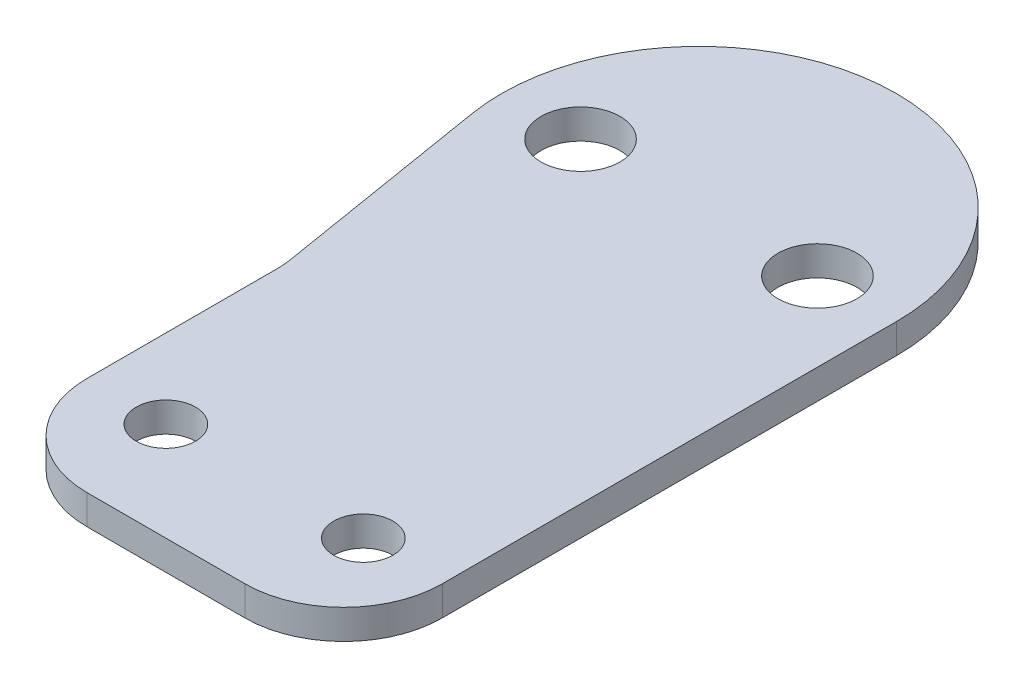
from build123d import *

# Parameters (mm, degrees)
SKETCH_1_R      = 1.5
SKETCH_1_R_2    = 2
EXTRUDE_1_DEPTH = 1.5
FILLET_1_R      = 5


with BuildPart() as part:
    # ｽｹｯﾁ1 → ﾎﾞｽ - 押し出し1 (new body)
    with BuildSketch(Plane(origin=(0, 0, 0), x_dir=(1, 0, 0), z_dir=(0, 1, 0))):
        with BuildLine():
            Line((-9, -4), (-9, -19))
            Line((-9, -19), (9, -19))
            Line((9, -19), (9, 9))
            ThreePointArc((9, 9), (-1.812547294, 18.966933676), (-10.867953379, 7.380279002))
            Line((-10.867953379, 7.380279002), (-9, -4))
        make_face()
        with Locations(Location((-5, -14, 0), (0, 0, 270))):
            Circle(SKETCH_1_R, mode=Mode.SUBTRACT)
        with Locations(Location((5, -14, 0), (0, 0, 270))):
            Circle(SKETCH_1_R, mode=Mode.SUBTRACT)
        with Locations(Location((-7, 9, 0), (0, 0, 270))):
            Circle(SKETCH_1_R_2, mode=Mode.SUBTRACT)
        with Locations(Location((5, 9, 0), (0, 0, 270))):
            Circle(SKETCH_1_R_2, mode=Mode.SUBTRACT)
    extrude(amount=EXTRUDE_1_DEPTH)

    # ﾌｨﾚｯﾄ1
    fillet_1_edges = [part.edges().sort_by_distance(p)[0] for p in [
        (9, 0.75, 19),
        (-9, 0.75, 19),
        (-9, 0.75, 4),
    ]]
    fillet(fillet_1_edges, radius=FILLET_1_R)


solid = part.part
